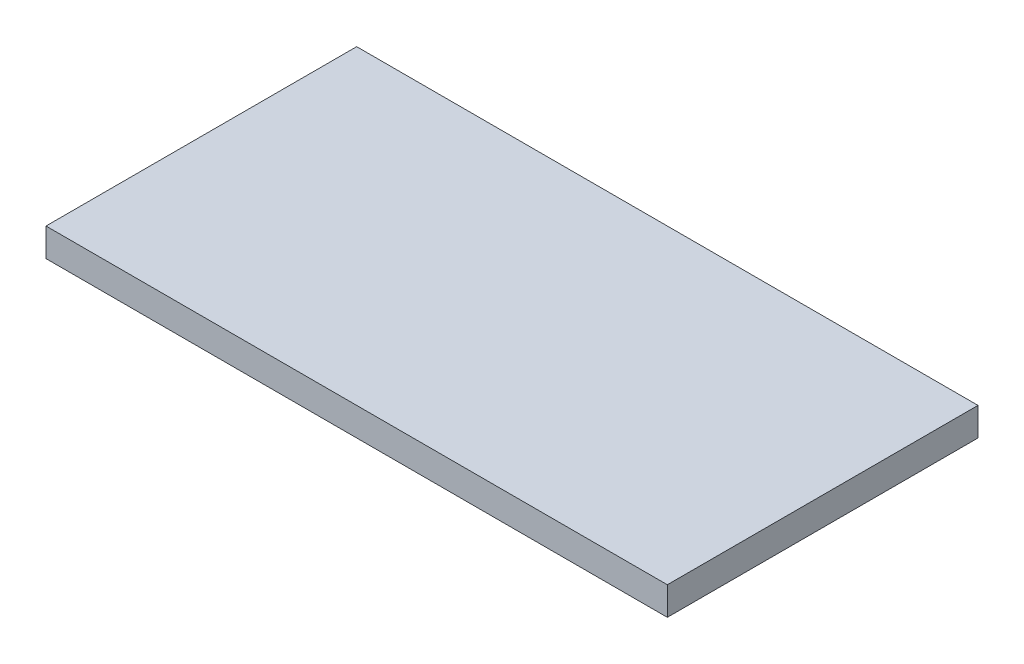
from build123d import *

# Parameters (mm, degrees)
SKETCH1_W           = 22
SKETCH1_H           = 11
BOSS_EXTRUDE1_DEPTH = 1


with BuildPart() as part:
    # Sketch1 → Boss-Extrude1 (new body)
    with BuildSketch(Plane(origin=(0, 0, 0), x_dir=(1, 0, 0), z_dir=(0, 1, 0))):
        with Locations((11, -5.5)):
            Rectangle(SKETCH1_W, SKETCH1_H)
    extrude(amount=BOSS_EXTRUDE1_DEPTH)


solid = part.part
